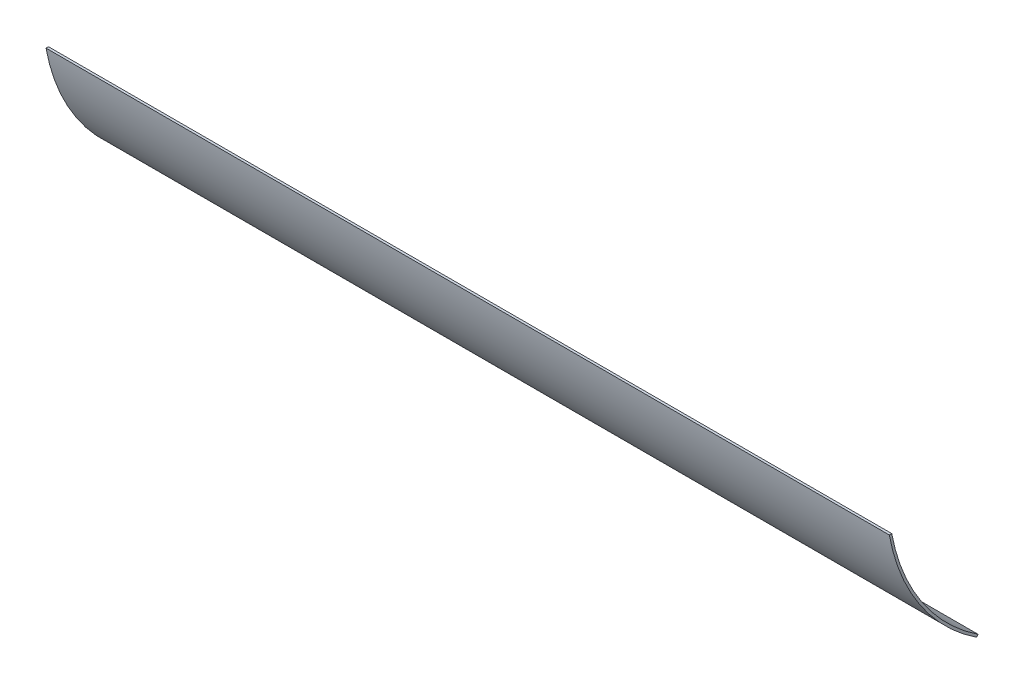
from build123d import *

# Parameters (mm, degrees)
BOSS_EXTRUDE1_DEPTH = 558.8


with BuildPart() as part:
    # Sketch1 → Boss-Extrude1 (new body)
    with BuildSketch(Plane(origin=(0, 0, 0), x_dir=(0, 0, -1), z_dir=(1, 0, 0))):
        with BuildLine():
            Line((-129.904053147, -23.876), (-131.517820771, -23.876))
            ThreePointArc((-131.517820771, -23.876), (-111.550059217, -73.644991988), (-73.628500901, -111.56094483))
            Line((-73.628500901, -111.56094483), (-72.754053147, -110.235992991))
            ThreePointArc((-72.754053147, -110.235992991), (-110.14576301, -72.890584378), (-129.904053147, -23.876))
        make_face()
    extrude(amount=BOSS_EXTRUDE1_DEPTH)


solid = part.part
